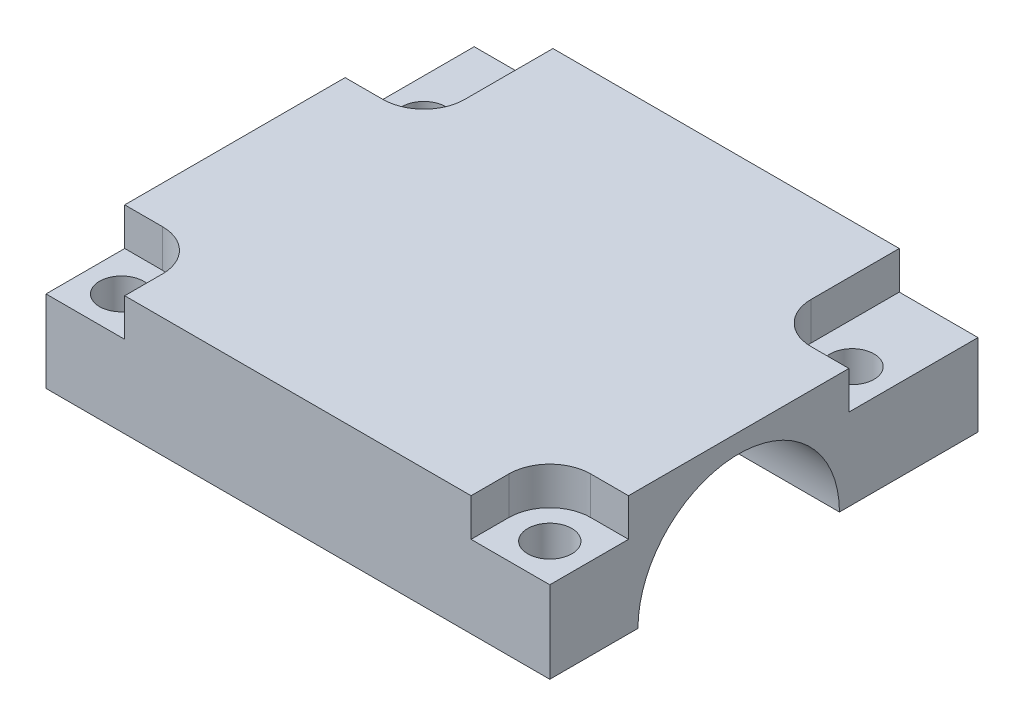
from build123d import *

# Parameters (mm, degrees)
SKETCH1_W            = 40
SKETCH1_H            = 34
SKETCH1_R            = 1.75
BOSS_EXTRUDE1_DEPTH  = 9.5
SKETCH2_R            = 8
CUT_EXTRUDE1_DEPTH   = 46.290727528
CUT_EXTRUDE2_DEPTH   = 3
MIRROR2_COPY_1_DEPTH = 3
SKETCH4_W            = 6.25
SKETCH4_H            = 4
CUT_EXTRUDE3_DEPTH   = 3


with BuildPart() as part:
    # Sketch1 → Boss-Extrude1 (new body)
    with BuildSketch(Plane(origin=(0, 0, 0), x_dir=(1, 0, 0), z_dir=(0, 1, 0))):
        with Locations((0, 2)):
            Rectangle(SKETCH1_W, SKETCH1_H)
        with Locations(Location((-17, 12, 0), (0, 0, 270))):
            Circle(SKETCH1_R, mode=Mode.SUBTRACT)
        with Locations(Location((17, 12, 0), (0, 0, 270))):
            Circle(SKETCH1_R, mode=Mode.SUBTRACT)
        with Locations(Location((17, -12, 0), (0, 0, 270))):
            Circle(SKETCH1_R, mode=Mode.SUBTRACT)
        with Locations(Location((-17, -12, 0), (0, 0, 270))):
            Circle(SKETCH1_R, mode=Mode.SUBTRACT)
    extrude(amount=BOSS_EXTRUDE1_DEPTH)

    # Sketch2 → Cut-Extrude1 (cut, through all)
    with BuildSketch(Plane(origin=(20, 0, 0), x_dir=(0, 0, -1), z_dir=(1, 0, 0))):
        Circle(SKETCH2_R)
    extrude(amount=-CUT_EXTRUDE1_DEPTH, mode=Mode.SUBTRACT)

    # Sketch3 → Cut-Extrude2 (cut)
    with BuildSketch(Plane(origin=(0, 9.5, 0), x_dir=(1, 0, 0), z_dir=(0, 1, 0))):
        with BuildLine():
            Line((-17, -8.75), (-20, -8.75))
            Line((-20, -8.75), (-20, -15))
            Line((-20, -15), (-13.75, -15))
            Line((-13.75, -15), (-13.75, -12))
            ThreePointArc((-13.75, -12), (-14.701902961, -9.701902961), (-17, -8.75))
        make_face()
    cut_extrude2 = extrude(amount=-CUT_EXTRUDE2_DEPTH, mode=Mode.SUBTRACT)

    # Mirror1: Cut-Extrude2 across plane
    add(cut_extrude2.mirror(Plane(origin=(0, 0, 0), x_dir=(0, 0, 1), z_dir=(1, 0, 0))), mode=Mode.SUBTRACT)

    # Mirror2: Cut-Extrude2 across plane
    add(cut_extrude2.mirror(Plane.XY), mode=Mode.SUBTRACT)

    # Mirror2 copy 1 sketch → Mirror2 copy 1 (cut)
    with BuildSketch(Plane(origin=(0, 9.5, 0), x_dir=(-1, 0, 0), z_dir=(0, 1, 0))):
        with BuildLine():
            Line((-17, -8.75), (-20, -8.75))
            Line((-20, -8.75), (-20, -15))
            Line((-20, -15), (-13.75, -15))
            Line((-13.75, -15), (-13.75, -12))
            ThreePointArc((-13.75, -12), (-14.701902961, -9.701902961), (-17, -8.75))
        make_face()
    extrude(amount=-MIRROR2_COPY_1_DEPTH, mode=Mode.SUBTRACT)

    # Sketch4 → Cut-Extrude3 (cut)
    with BuildSketch(Plane(origin=(0, 9.5, 0), x_dir=(1, 0, 0), z_dir=(0, 1, 0))):
        with Locations((-16.875, 17)):
            Rectangle(SKETCH4_W, SKETCH4_H)
        with Locations((16.875, 17)):
            Rectangle(SKETCH4_W, SKETCH4_H)
    extrude(amount=-CUT_EXTRUDE3_DEPTH, mode=Mode.SUBTRACT)


solid = part.part
